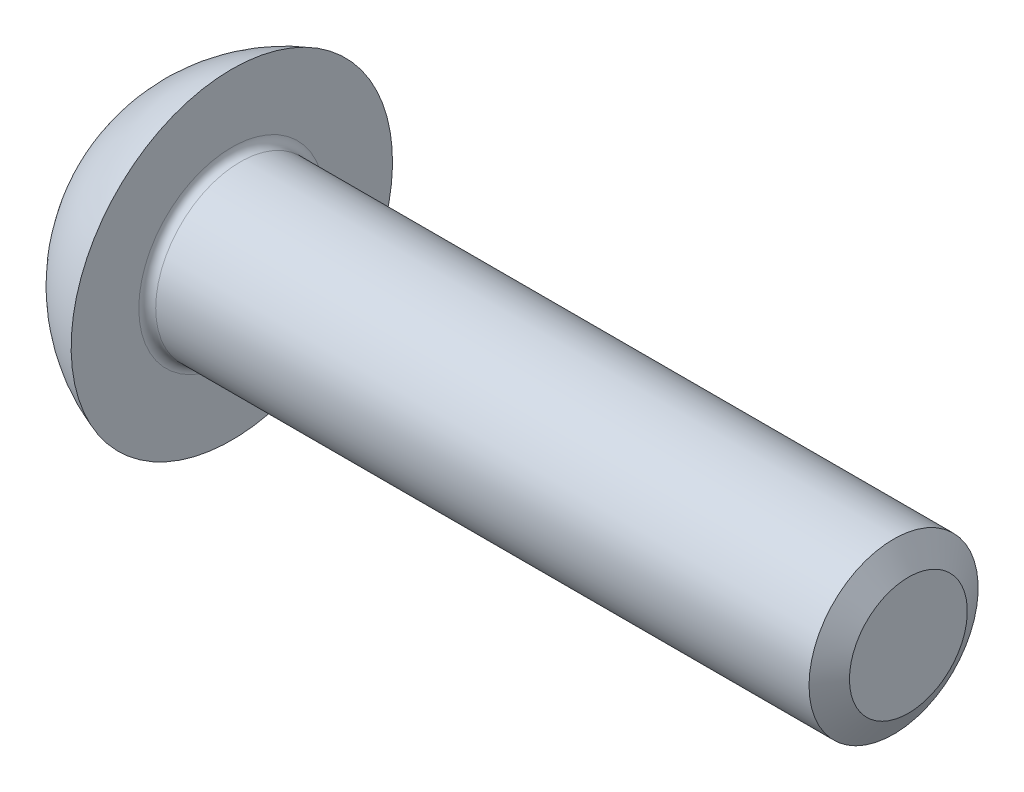
from build123d import *

# Parameters (mm, degrees)
CUT_EXTRUDE_1_DEPTH = 2.2


with BuildPart() as part:
    # 草图1 → 旋转1 (revolve)
    with BuildSketch(Plane.XY):
        with BuildLine():
            Line((0, 2), (-15.8, 2))
            ThreePointArc((-15.8, 2), (-15.941421356, 2.058578644), (-16, 2.2))
            Line((-16, 2.2), (-16, 3.8))
            ThreePointArc((-16, 3.8), (-17.264955669, 3.101612484), (-18.2, 2))
            Line((-18.2, 2), (-18.2, 0))
            Line((-18.2, 0), (0, 0))
            Line((0, 0), (0, 2))
        make_face()
    revolve(axis=Axis((-18.2, 0, 0), (1, 0, 0)))

    # 草图2 → 切除-拉伸1 (cut)
    with BuildSketch(Plane.ZY.offset(18.2)):
        Polygon((0, 1.443375673), (-1.25, 0.721687836), (-1.25, -0.721687836), (0, -1.443375673), (1.25, -0.721687836), (1.25, 0.721687836), align=None)
    extrude(amount=-CUT_EXTRUDE_1_DEPTH, mode=Mode.SUBTRACT)

    # 草图6 → 旋转2 (revolve)
    with BuildSketch(Plane.XY):
        Polygon((-16.9, 1.443375673), (-16, 0), (-15.63, 0), (-15.63, 1.443375673), align=None)
    revolve(axis=Axis((-18.2, 0, 0), (1, 0, 0)))

    # 草图7 → 切除-旋转5 (revolve, cut)
    with BuildSketch(Plane.XY):
        Polygon((-18.2, 1.443375673), (-17.83, 0), (-18.2, 0), align=None)
    revolve(axis=Axis((-18.2, 0, 0), (1, 0, 0)), mode=Mode.SUBTRACT)

    # 草图4 → 切除-旋转1 (revolve, cut)
    with BuildSketch(Plane.XY):
        Polygon((-0.35, 2), (0, 1.393782217), (0.35, 2), align=None)
    revolve(axis=Axis((-0.35, 0, 0), (1, 0, 0)), mode=Mode.SUBTRACT)


solid = part.part
